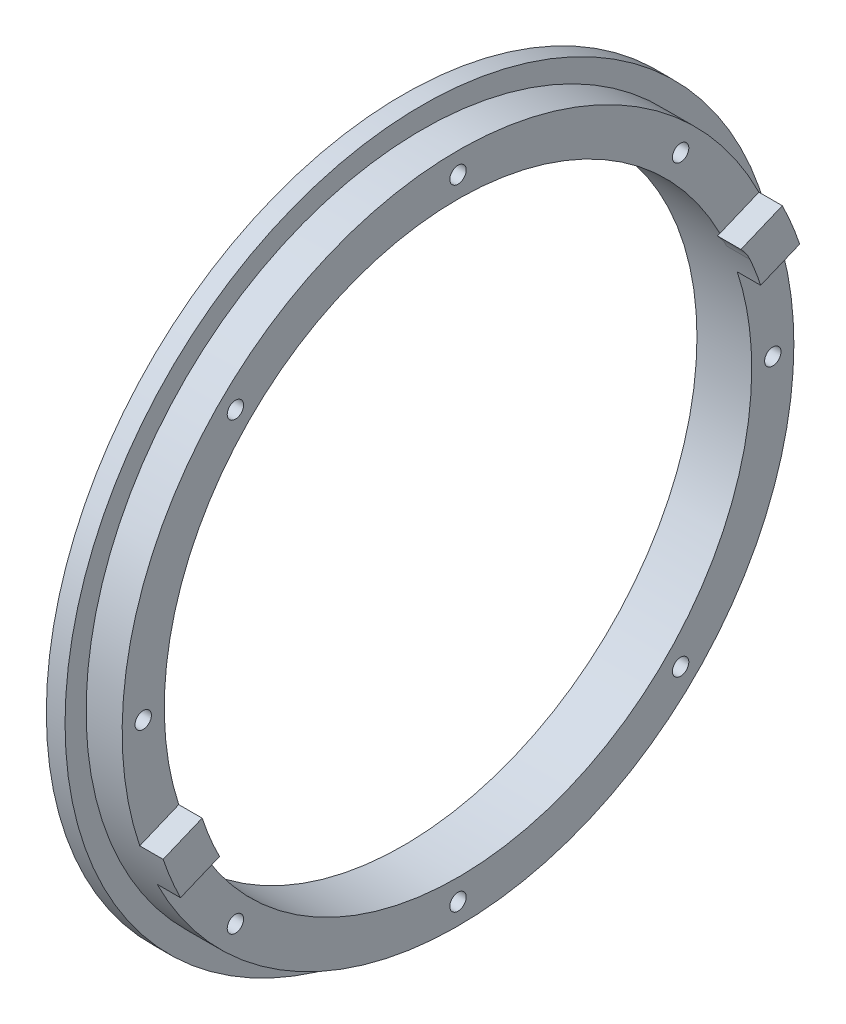
from build123d import *

# Parameters (mm, degrees)
CUT_EXTRUDE_1_DEPTH       = 5
CUT_EXTRUDE_2_DEPTH       = 5
EXTRUDE_1_DEPTH           = 5
HOLE_WIZARD_1_D           = 3.5
HOLE_WIZARD_1_DEPTH       = 16.7
HOLE_WIZARD_1_CBORE_D     = 6.5
HOLE_WIZARD_1_CBORE_DEPTH = 2
HOLE_WIZARD_2_D           = 3.5
HOLE_WIZARD_2_DEPTH       = 16.7
HOLE_WIZARD_2_CBORE_D     = 6.5
HOLE_WIZARD_2_CBORE_DEPTH = 2
HOLE_WIZARD_3_D           = 3.5
HOLE_WIZARD_3_DEPTH       = 16.7
HOLE_WIZARD_3_CBORE_D     = 6.5
HOLE_WIZARD_3_CBORE_DEPTH = 2
HOLE_WIZARD_4_D           = 3.5
HOLE_WIZARD_4_DEPTH       = 16.7
HOLE_WIZARD_4_CBORE_D     = 6.5
HOLE_WIZARD_4_CBORE_DEPTH = 2
HOLE_WIZARD_5_D           = 3.5
HOLE_WIZARD_5_DEPTH       = 16.7
HOLE_WIZARD_5_CBORE_D     = 6.5
HOLE_WIZARD_5_CBORE_DEPTH = 2
HOLE_WIZARD_6_D           = 3.5
HOLE_WIZARD_6_DEPTH       = 16.7
HOLE_WIZARD_6_CBORE_D     = 6.5
HOLE_WIZARD_6_CBORE_DEPTH = 2
HOLE_WIZARD_7_D           = 3.5
HOLE_WIZARD_7_DEPTH       = 16.7
HOLE_WIZARD_7_CBORE_D     = 6.5
HOLE_WIZARD_7_CBORE_DEPTH = 2
HOLE_WIZARD_8_D           = 3.5
HOLE_WIZARD_8_DEPTH       = 16.7
HOLE_WIZARD_8_CBORE_D     = 6.5
HOLE_WIZARD_8_CBORE_DEPTH = 2


with BuildPart() as part:
    # 草图2 → 旋转1 (revolve)
    with BuildSketch(Plane.XY, mode=Mode.PRIVATE) as revolve_1_sk:
        Polygon((-30.3, 71.75), (-43, 71.75), (-43, 76.25), (-47, 76.25), (-47, 62.75), (-30.3, 62.75), align=None)
    revolve(revolve_1_sk.sketch.rotate(Axis((-47, 0, 0), (1, 0, 0)), 270), axis=Axis((-47, 0, 0), (1, 0, 0)))

    # 草图3 → 切除-拉伸1 (cut)
    with BuildSketch(Plane(origin=(-30.3, 0, 0), x_dir=(0, 0, -1), z_dir=(1, 0, 0))):
        with BuildLine():
            Line((55.944003631, 28.422367209), (64.280726218, 31.87555077))
            ThreePointArc((64.280726218, 31.87555077), (-27.457536272, 66.288356458), (-67.992755512, -22.913919305))
            Line((-67.992755512, -22.913919305), (-59.656032925, -19.460735743))
            ThreePointArc((-59.656032925, -19.460735743), (-24.013385381, 57.973440665), (55.944003631, 28.422367209))
        make_face()
    extrude(amount=-CUT_EXTRUDE_1_DEPTH, mode=Mode.SUBTRACT)

    # 草图4 → 切除-拉伸2 (cut)
    with BuildSketch(Plane(origin=(-30.3, 0, 0), x_dir=(0, 0, -1), z_dir=(1, 0, 0))):
        with BuildLine():
            Line((-55.944003631, -28.422367209), (-64.280726218, -31.87555077))
            ThreePointArc((-64.280726218, -31.87555077), (27.457536272, -66.288356458), (67.992755512, 22.913919305))
            Line((67.992755512, 22.913919305), (59.656032925, 19.460735743))
            ThreePointArc((59.656032925, 19.460735743), (24.013385381, -57.973440665), (-55.944003631, -28.422367209))
        make_face()
    extrude(amount=-CUT_EXTRUDE_2_DEPTH, mode=Mode.SUBTRACT)

    # 草图5 → 凸台-拉伸1 (add)
    with BuildSketch(Plane(origin=(-30.3, 0, 0), x_dir=(0, 0, -1), z_dir=(1, 0, 0))):
        with BuildLine():
            Line((55.944003631, 28.422367209), (55.431709583, 28.210168066))
            ThreePointArc((55.431709583, 28.210168066), (56.54956954, 26.875405525), (57.39905958, 25.355679036))
            ThreePointArc((57.39905958, 25.355679036), (56.692271418, 26.898863571), (55.944003631, 28.422367209))
        make_face()
    extrude(amount=-EXTRUDE_1_DEPTH)

    # 孔1
    with Locations(Plane.ZY.offset(47)):
        with Locations((-67.25, 0)):
            CounterBoreHole(HOLE_WIZARD_1_D / 2, HOLE_WIZARD_1_CBORE_D / 2, HOLE_WIZARD_1_CBORE_DEPTH, depth=HOLE_WIZARD_1_DEPTH)

    # 孔2
    with Locations(Plane.ZY.offset(47)):
        with Locations((-47.552931035, 47.552931035)):
            CounterBoreHole(HOLE_WIZARD_2_D / 2, HOLE_WIZARD_2_CBORE_D / 2, HOLE_WIZARD_2_CBORE_DEPTH, depth=HOLE_WIZARD_2_DEPTH)

    # 孔3
    with Locations(Plane.ZY.offset(47)):
        with Locations((0, 67.25)):
            CounterBoreHole(HOLE_WIZARD_3_D / 2, HOLE_WIZARD_3_CBORE_D / 2, HOLE_WIZARD_3_CBORE_DEPTH, depth=HOLE_WIZARD_3_DEPTH)

    # 孔4
    with Locations(Plane.ZY.offset(47)):
        with Locations((47.552931035, 47.552931035)):
            CounterBoreHole(HOLE_WIZARD_4_D / 2, HOLE_WIZARD_4_CBORE_D / 2, HOLE_WIZARD_4_CBORE_DEPTH, depth=HOLE_WIZARD_4_DEPTH)

    # 孔5
    with Locations(Plane.ZY.offset(47)):
        with Locations((67.25, 0)):
            CounterBoreHole(HOLE_WIZARD_5_D / 2, HOLE_WIZARD_5_CBORE_D / 2, HOLE_WIZARD_5_CBORE_DEPTH, depth=HOLE_WIZARD_5_DEPTH)

    # 孔6
    with Locations(Plane.ZY.offset(47)):
        with Locations((47.552931035, -47.552931035)):
            CounterBoreHole(HOLE_WIZARD_6_D / 2, HOLE_WIZARD_6_CBORE_D / 2, HOLE_WIZARD_6_CBORE_DEPTH, depth=HOLE_WIZARD_6_DEPTH)

    # 孔7
    with Locations(Plane.ZY.offset(47)):
        with Locations((0, -67.25)):
            CounterBoreHole(HOLE_WIZARD_7_D / 2, HOLE_WIZARD_7_CBORE_D / 2, HOLE_WIZARD_7_CBORE_DEPTH, depth=HOLE_WIZARD_7_DEPTH)

    # 孔8
    with Locations(Plane.ZY.offset(47)):
        with Locations((-47.552931035, -47.552931035)):
            CounterBoreHole(HOLE_WIZARD_8_D / 2, HOLE_WIZARD_8_CBORE_D / 2, HOLE_WIZARD_8_CBORE_DEPTH, depth=HOLE_WIZARD_8_DEPTH)


solid = part.part
